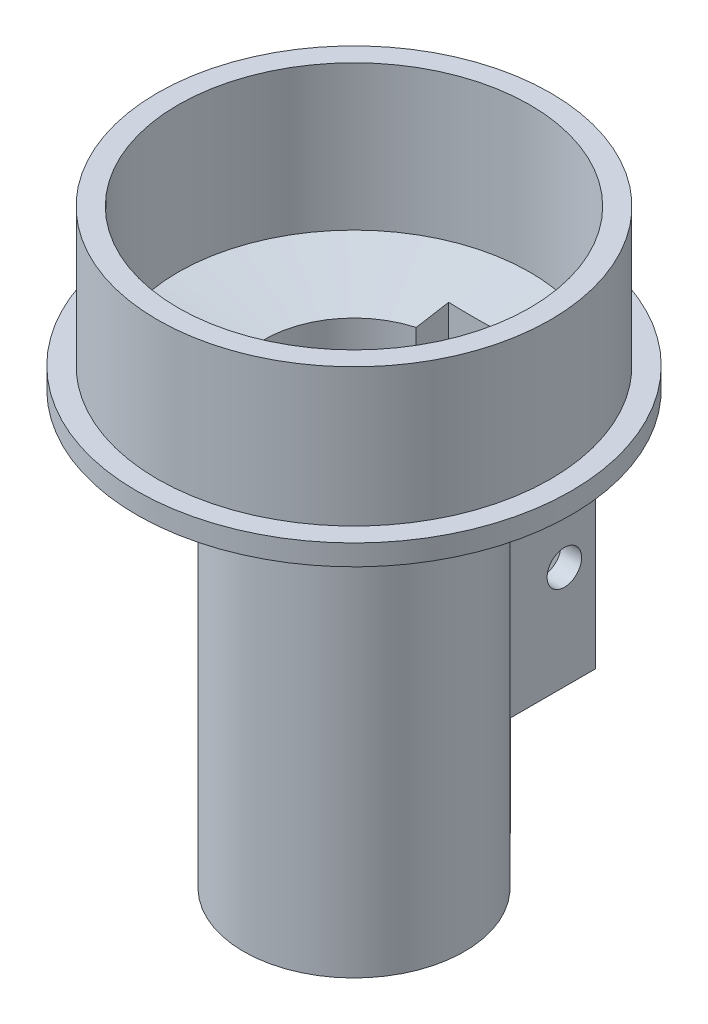
from build123d import *

# Parameters (mm, degrees)
CROQUIS2_W              = 20
CROQUIS2_H              = 9
SALIENTE_EXTRUIR1_DEPTH = 30
CROQUIS3_R              = 2.5
CORTAR_EXTRUIR1_DEPTH   = 30
SALIENTE_EXTRUIR2_REACH = 161.769
CROQUIS4_W              = 20
CROQUIS4_H              = 30
CROQUIS5_W              = 14
CROQUIS5_H              = 24
CORTAR_EXTRUIR2_DEPTH   = 11.010004003
SALIENTE_EXTRUIR3_REACH = 98.487
CORTAR_EXTRUIR3_REACH   = 98.487


with BuildPart() as part:
    # Croquis1 → Revolución1 (revolve)
    with BuildSketch(Plane(origin=(0, 0, 0), x_dir=(0, 0, -1), z_dir=(1, 0, 0))):
        Polygon((28.5, 149.256566287), (28.5, 129.256566287), (31.5, 129.256566287), (31.5, 126.256566287), (16, 123.523498086), (16, 63.6684817), (13, 63.6684817), (13, 126.040796979), (25.5, 128.244884238), (25.5, 149.256566287), align=None)
    revolve(axis=Axis((0, 0, 0), (0, 1, 0)))

    # Croquis4 → Saliente-Extruir2 (add, up to next)
    with BuildSketch(Plane.XY.offset(-16), mode=Mode.PRIVATE) as saliente_extruir2_sk1:
        with Locations((0, 98.6684817)):
            Rectangle(CROQUIS4_W, CROQUIS4_H)
    saliente_extruir2_tool1 = extrude(saliente_extruir2_sk1.sketch, amount=SALIENTE_EXTRUIR2_REACH, mode=Mode.PRIVATE) - part.part


with BuildPart() as body_2:
    # Croquis2 → Saliente-Extruir1 (new body)
    with BuildSketch(Plane(origin=(0, 83.6684817, 0), x_dir=(-1, 0, 0), z_dir=(0, -1, 0))):
        with Locations((0, 20.5)):
            Rectangle(CROQUIS2_W, CROQUIS2_H)
    extrude(amount=-SALIENTE_EXTRUIR1_DEPTH)

    # Croquis3 → Cortar-Extruir1 (cut)
    with BuildSketch(Plane(origin=(10, 0, 0), x_dir=(0, 0, -1), z_dir=(1, 0, 0))):
        with Locations((20.5, 98.6684817)):
            Circle(CROQUIS3_R)
    extrude(amount=-CORTAR_EXTRUIR1_DEPTH, mode=Mode.SUBTRACT)


with BuildPart() as part_1:
    add(part.part)

    add(body_2.part)  # Saliente-Extruir2 merges body 2
    add(saliente_extruir2_tool1.solids().sort_by_distance((0, 98.668482, -16))[0])
    add(saliente_extruir2_tool1.solids().sort_by_distance((0, 98.668482, -16))[1])

    # Croquis5 → Cortar-Extruir2 (cut)
    with BuildSketch(Plane(origin=(0, 0, -12.489995997), x_dir=(-1, 0, 0), z_dir=(0, 0, -1))):
        with Locations((0, 98.6684817)):
            Rectangle(CROQUIS5_W, CROQUIS5_H)
    extrude(amount=CORTAR_EXTRUIR2_DEPTH, mode=Mode.SUBTRACT)

    # Saliente-Extruir3: up to this cone (the profile starts outside it)
    saliente_extruir3_end = Plane(origin=(0, 63.668482, 0), z_dir=(0, 1, 0)).offset(57.033785394) * Cone(5.671e-06, 237.928508939, 41.953214606, align=(Align.CENTER, Align.CENTER, Align.MIN), mode=Mode.PRIVATE)
    # Croquis6 → Saliente-Extruir3 (add, up to the surface)
    with BuildSketch(Plane.XZ.offset(-63.6684817), mode=Mode.PRIVATE) as saliente_extruir3_sk1:
        with BuildLine():
            Line((0, -18.227740962), (0, -16))
            ThreePointArc((0, -16), (-2.273055155, -15.837715121), (-4.5, -15.354152533))
            Line((-4.5, -15.354152533), (-4.5, -18.227740962))
            Line((-4.5, -18.227740962), (0, -18.227740962))
        make_face()
    saliente_extruir3_tool1 = extrude(saliente_extruir3_sk1.sketch, amount=-SALIENTE_EXTRUIR3_REACH, mode=Mode.PRIVATE) - saliente_extruir3_end
    add(saliente_extruir3_tool1.solids().sort_by_distance((-2.348795, 63.668482, -16.999565))[0])
    # Croquis6 → Saliente-Extruir3 (add, up to the surface)
    with BuildSketch(Plane.XZ.offset(-63.6684817), mode=Mode.PRIVATE) as saliente_extruir3_sk2:
        with BuildLine():
            ThreePointArc((4.5, -15.354152533), (2.273055155, -15.837715121), (0, -16))
            Line((0, -16), (0, -18.227740962))
            Line((0, -18.227740962), (4.5, -18.227740962))
            Line((4.5, -18.227740962), (4.5, -15.354152533))
        make_face()
    saliente_extruir3_tool2 = extrude(saliente_extruir3_sk2.sketch, amount=-SALIENTE_EXTRUIR3_REACH, mode=Mode.PRIVATE) - saliente_extruir3_end
    add(saliente_extruir3_tool2.solids().sort_by_distance((2.348795, 63.668482, -16.999565))[0])

    # Cortar-Extruir3: up to this cone (the profile starts outside it)
    cortar_extruir3_end = Plane(origin=(0, 63.668482, 0), z_dir=(0, 1, 0)).offset(60.08006523) * Cone(5.671e-06, 220.65219749, 38.90693477, align=(Align.CENTER, Align.CENTER, Align.MIN), mode=Mode.PRIVATE)
    # Croquis7 → Cortar-Extruir3 (cut, up to the surface)
    with BuildSketch(Plane.XZ.offset(-63.6684817), mode=Mode.PRIVATE) as cortar_extruir3_sk1:
        with BuildLine():
            Line((3.5, -17.227740962), (3.5, -15.354152533))
            Line((3.5, -15.354152533), (3.5, -12.519984026))
            ThreePointArc((3.5, -12.519984026), (0, -13), (-3.5, -12.519984026))
            Line((-3.5, -12.519984026), (-3.5, -15.354152533))
            Line((-3.5, -15.354152533), (-3.5, -17.227740962))
            Line((-3.5, -17.227740962), (3.5, -17.227740962))
        make_face()
    cortar_extruir3_tool1 = extrude(cortar_extruir3_sk1.sketch, amount=-CORTAR_EXTRUIR3_REACH, mode=Mode.PRIVATE) - cortar_extruir3_end
    add(cortar_extruir3_tool1.solids().sort_by_distance((0, 63.668482, -15.032146))[0], mode=Mode.SUBTRACT)


solid = part_1.part
